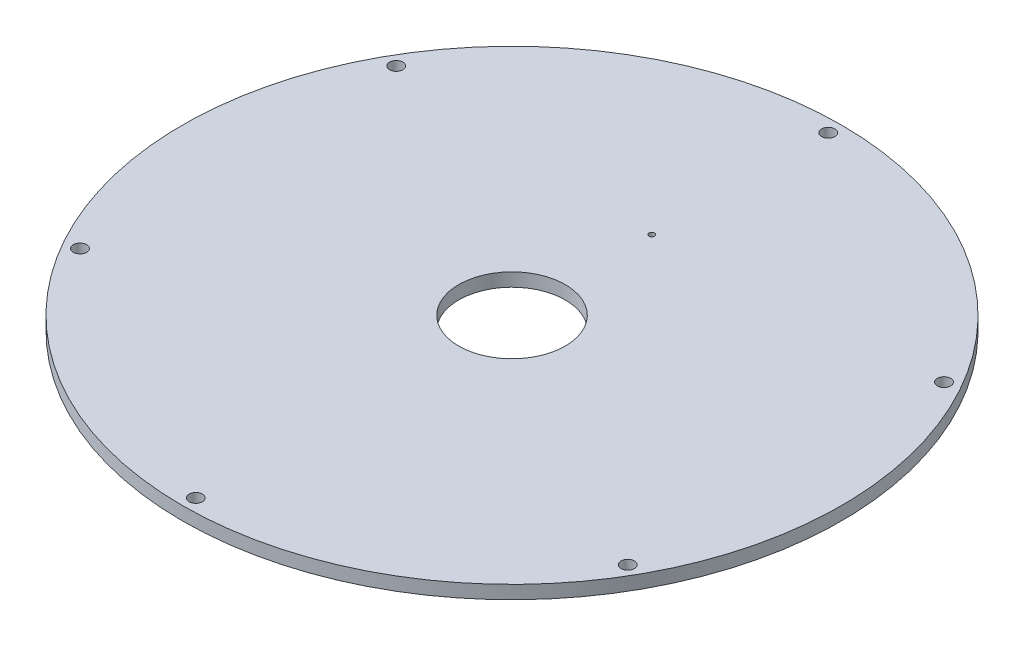
from build123d import *

# Parameters (mm, degrees)
SKETCH1_R               = 49.5
SKETCH1_R_2             = 8
SKETCH1_R_3             = 1
BOSS_EXTRUDE1_DEPTH     = 2
CUT_EXTRUDE1_DEPTH      = 71.032135481
CUT_EXTRUDE1_DEPTH_BACK = 71.032135481
SKETCH2_R               = 0.42
SKETCH3_R               = 1
CUT_EXTRUDE2_DEPTH      = 1


with BuildPart() as part:
    # Sketch1 → Boss-Extrude1 (new body)
    with BuildSketch(Plane(origin=(0, 0, 0), x_dir=(1, 0, 0), z_dir=(0, 1, 0))):
        with Locations(Location((0, 0, 0), (0, 0, 270))):
            Circle(SKETCH1_R)
        with Locations(Location((0, 0, 0), (0, 0, 270))):
            Circle(SKETCH1_R_2, mode=Mode.SUBTRACT)
        with Locations(Location((0, 47.5, 0), (0, 0, 270))):
            Circle(SKETCH1_R_3, mode=Mode.SUBTRACT)
        with Locations(Location((41.13620668, 23.75, 0), (0, 0, 270))):
            Circle(SKETCH1_R_3, mode=Mode.SUBTRACT)
        with Locations(Location((41.13620668, -23.75, 0), (0, 0, 270))):
            Circle(SKETCH1_R_3, mode=Mode.SUBTRACT)
        with Locations(Location((0, -47.5, 0), (0, 0, 270))):
            Circle(SKETCH1_R_3, mode=Mode.SUBTRACT)
        with Locations(Location((-41.13620668, -23.75, 0), (0, 0, 270))):
            Circle(SKETCH1_R_3, mode=Mode.SUBTRACT)
        with Locations(Location((-41.13620668, 23.75, 0), (0, 0, 270))):
            Circle(SKETCH1_R_3, mode=Mode.SUBTRACT)
    extrude(amount=BOSS_EXTRUDE1_DEPTH)

    # Sketch2 → Cut-Extrude1 (cut, two sides: drawn at the far end of the back side and taken through both)
    with BuildSketch(Plane(origin=(0, 2, 0), x_dir=(1, 0, 0), z_dir=(0, 1, 0)).offset(-CUT_EXTRUDE1_DEPTH_BACK)):
        with Locations(Location((0, 21, 0), (0, 0, 270))):
            Circle(SKETCH2_R)
    extrude(amount=CUT_EXTRUDE1_DEPTH + CUT_EXTRUDE1_DEPTH_BACK, mode=Mode.SUBTRACT)

    # Sketch3 → Cut-Extrude2 (cut)
    with BuildSketch(Plane.XZ):
        with Locations(Location((-6.15636258, 16.914467174, 0), (0, 0, 270))):
            Circle(SKETCH3_R)
        with Locations(Location((-6.15636258, -16.914467174, 0), (0, 0, 270))):
            Circle(SKETCH3_R)
        with Locations(Location((18, 0, 0), (0, 0, 270))):
            Circle(SKETCH3_R)
    extrude(amount=-CUT_EXTRUDE2_DEPTH, mode=Mode.SUBTRACT)


solid = part.part
